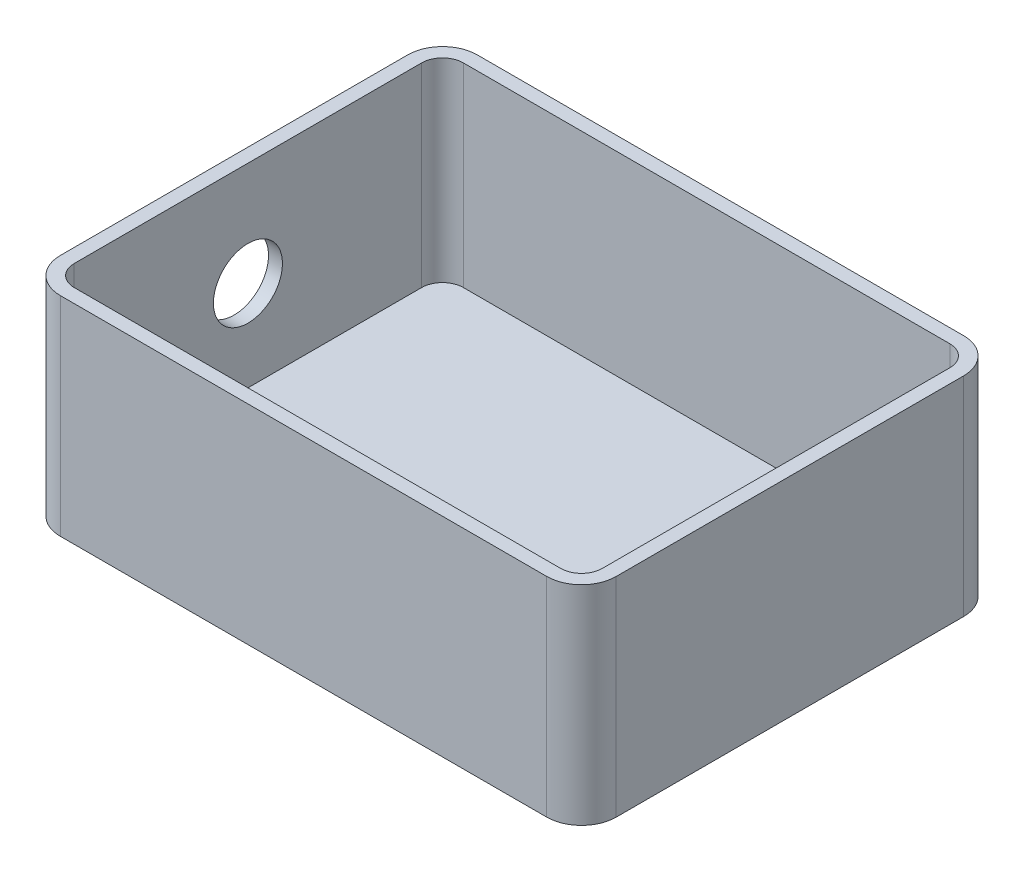
from build123d import *

# Parameters (mm, degrees)
SKETCH1_W        = 101.6
SKETCH1_H        = 76.2
BODY_DEPTH       = 38.1
CORNER_FILLETS_R = 6.35
SHELL_T          = -2.54
CABLE_HOLE_REACH = 117.003
SKETCH2_R        = 6.307285196


with BuildPart() as part:
    # Sketch1 → Body (new body)
    with BuildSketch(Plane(origin=(0, 0, 0), x_dir=(1, 0, 0), z_dir=(0, 1, 0))):
        Rectangle(SKETCH1_W, SKETCH1_H)
    extrude(amount=BODY_DEPTH)

    # Corner Fillets
    corner_fillets_edges = [part.edges().sort_by_distance(p)[0] for p in [
        (50.8, 19.05, 38.1),
        (-50.8, 19.05, 38.1),
        (-50.8, 19.05, -38.1),
        (50.8, 19.05, -38.1),
    ]]
    fillet(corner_fillets_edges, radius=CORNER_FILLETS_R)

    # Shell
    shell_openings = [part.faces().sort_by_distance(p)[0] for p in [
        (0, 38.1, 0),
    ]]
    offset(amount=SHELL_T, openings=shell_openings, kind=Kind.INTERSECTION)

    # Sketch2 → Cable Hole (cut, up to next)
    with BuildSketch(Plane.ZY.offset(50.8), mode=Mode.PRIVATE) as cable_hole_sk1:
        with Locations((0, 19.085434186)):
            Circle(SKETCH2_R)
    cable_hole_tool1 = extrude(cable_hole_sk1.sketch, amount=-CABLE_HOLE_REACH, mode=Mode.PRIVATE) & part.part
    add(cable_hole_tool1.solids().sort_by_distance((-50.8, 19.085434, 0))[0], mode=Mode.SUBTRACT)


solid = part.part
